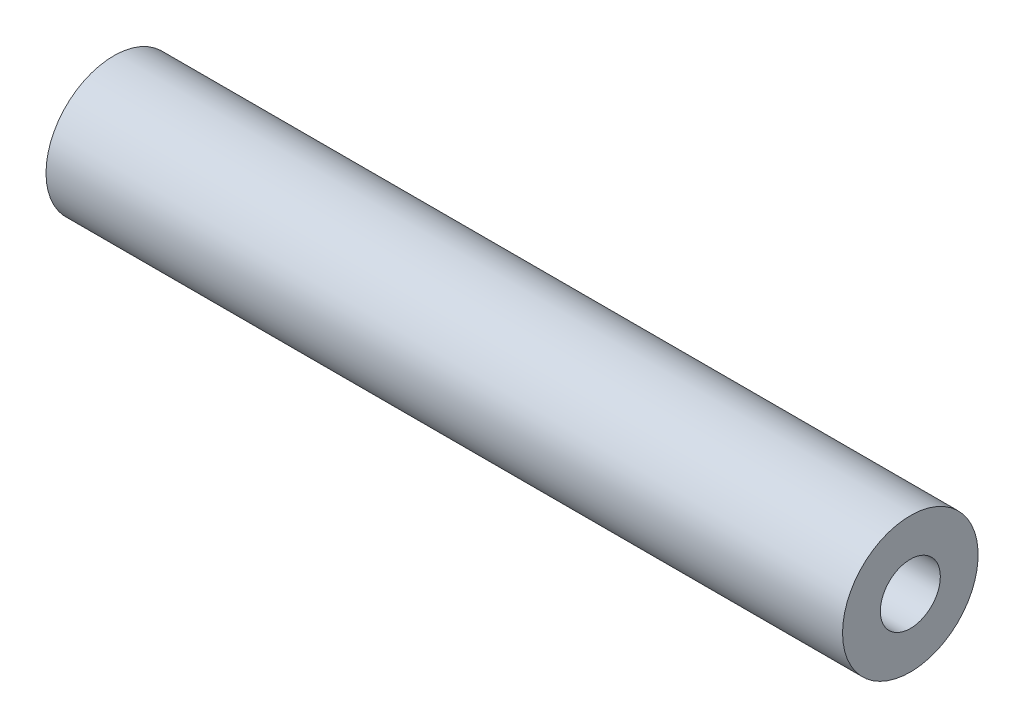
from build123d import *

# Parameters (mm, degrees)
SKETCH1_R              = 5.08
BOSS_EXTRUDE1_DEPTH    = 59.69
F_12_24_TAPPED_HOLE1_D = 4.4958


with BuildPart() as part:
    # Sketch1 → Boss-Extrude1 (new body)
    with BuildSketch(Plane(origin=(0, 0, 0), x_dir=(0, 0, -1), z_dir=(1, 0, 0))):
        with Locations(Location((0, 0, 0), (0, 0, 180))):
            Circle(SKETCH1_R)
    extrude(amount=BOSS_EXTRUDE1_DEPTH)

    # #12-24 Tapped Hole1 (through all)
    with Locations(Plane(origin=(59.69, 0, 0), x_dir=(0, 0, -1), z_dir=(1, 0, 0))):
        with Locations((0, 0)):
            Hole(F_12_24_TAPPED_HOLE1_D / 2)


solid = part.part
